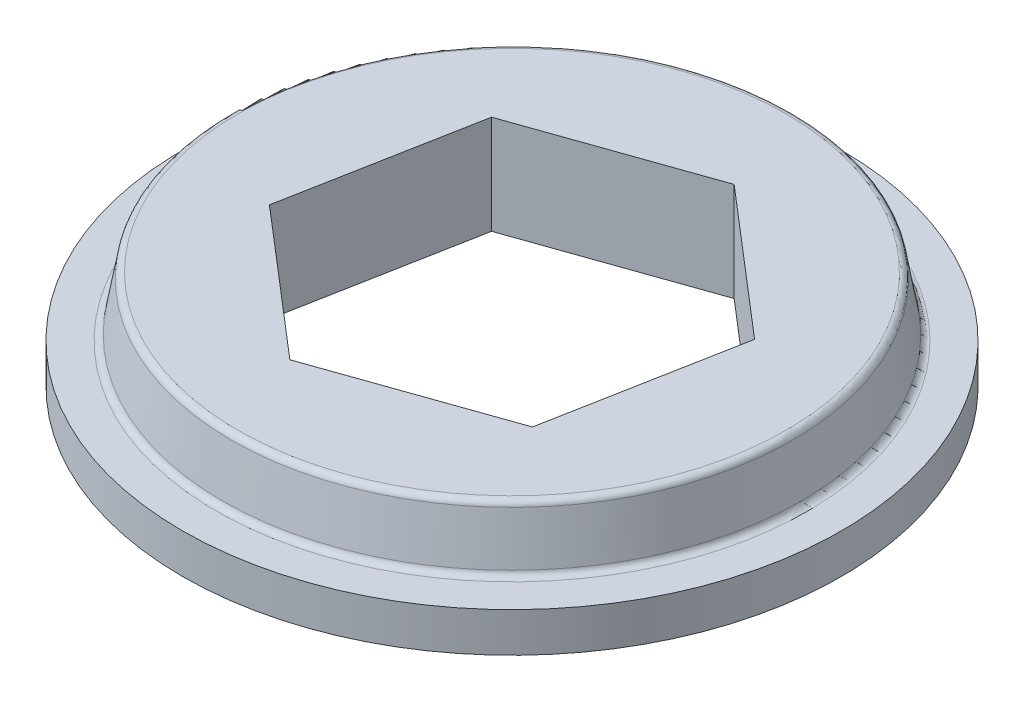
from build123d import *

# Parameters (mm, degrees)
CUT_EXTRUDE1_DEPTH = 19.360177014
FILLET1_R          = 0.254


with BuildPart() as part:
    # Sketch1 → Revolve1 (revolve)
    with BuildSketch(Plane(origin=(0, 0, 0), x_dir=(0, 0, -1), z_dir=(1, 0, 0)), mode=Mode.PRIVATE) as revolve1_sk:
        Polygon((0, 3.81), (10.772916522, 3.81), (11.176, 1.524), (12.7, 1.524), (12.7, 0), (0, 0), align=None)
    revolve(revolve1_sk.sketch.rotate(Axis((0, 8.524875, 0), (0, -1, 0)), 180), axis=Axis((0, 8.524875, 0), (0, -1, 0)))

    # Sketch2 → Cut-Extrude1 (cut, through all)
    with BuildSketch(Plane(origin=(0, 3.81, 0), x_dir=(1, 0, 0), z_dir=(0, 1, 0))):
        Polygon((5.563452778, -4.776120446), (6.917968027, 2.430031215), (1.354515249, 7.206151662), (-5.563452778, 4.776120446), (-6.917968027, -2.430031215), (-1.354515249, -7.206151662), align=None)
    extrude(amount=-CUT_EXTRUDE1_DEPTH, mode=Mode.SUBTRACT)

    # Fillet1
    fillet1_edges = [part.edges().sort_by_distance(p)[0] for p in [
        (0, 1.524, -11.176),
        (0, 3.81, -10.772916522),
    ]]
    fillet(fillet1_edges, radius=FILLET1_R)


solid = part.part
